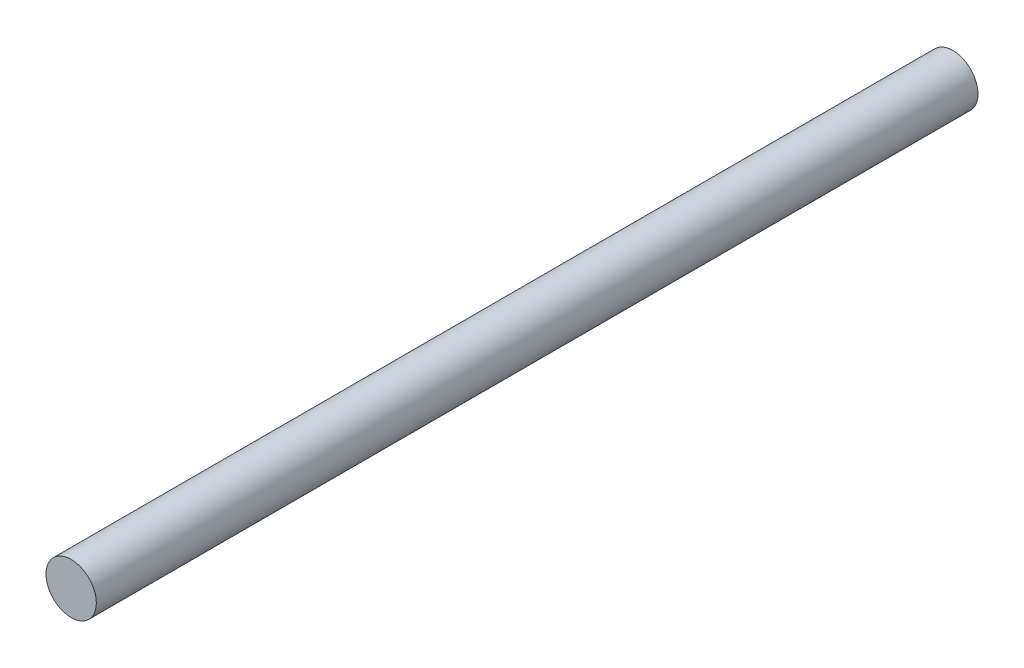
from build123d import *

# Parameters (mm, degrees)
SKETCH1_R           = 2
BOSS_EXTRUDE1_DEPTH = 70
SKETCH2_R           = 1
CUT_EXTRUDE1_DEPTH  = 8


with BuildPart() as part:
    # Sketch1 → Boss-Extrude1 (new body)
    with BuildSketch(Plane.XY):
        Circle(SKETCH1_R)
    extrude(amount=BOSS_EXTRUDE1_DEPTH)

    # Sketch2 → Cut-Extrude1 (cut)
    with BuildSketch(Plane(origin=(0, 0, 0), x_dir=(-1, 0, 0), z_dir=(0, 0, -1))):
        Circle(SKETCH2_R)
    extrude(amount=-CUT_EXTRUDE1_DEPTH, mode=Mode.SUBTRACT)


solid = part.part
